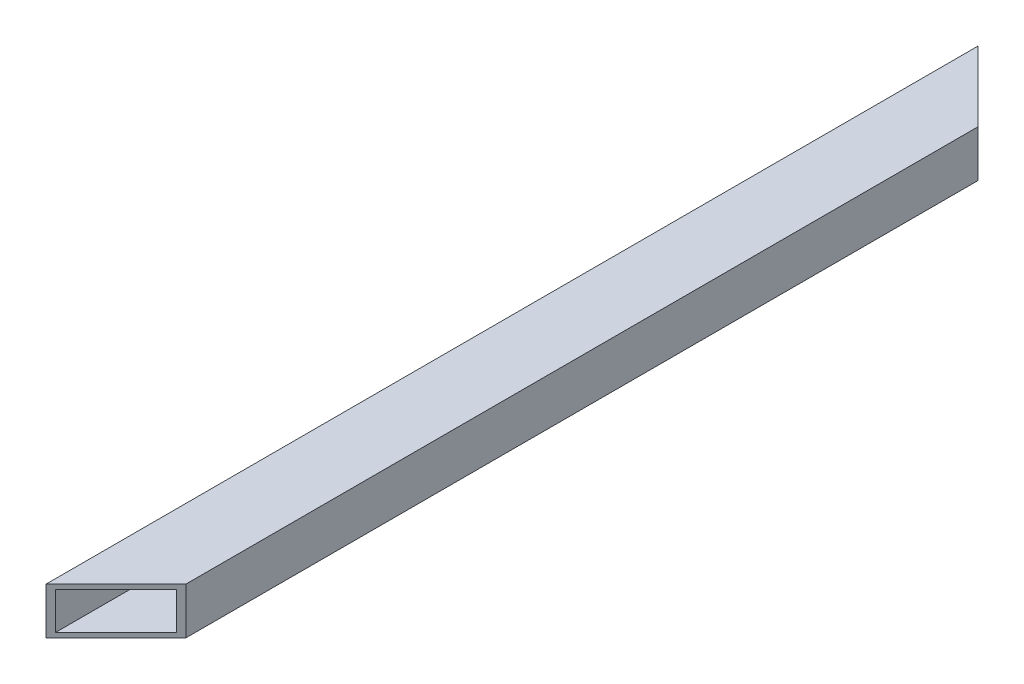
from build123d import *

# Parameters (mm, degrees)
SCHIZZO1_W                   = 30
SCHIZZO1_H                   = 20
SCHIZZO1_W_2                 = 26
SCHIZZO1_H_2                 = 16
ESTRUSIONE_ESTRUSIONE1_DEPTH = 400
TAGLIO_ESTRUSIONE1_DEPTH     = 401.780488547


with BuildPart() as part:
    # Schizzo1 → Estrusione-Estrusione1 (new body)
    with BuildSketch(Plane.XY):
        Rectangle(SCHIZZO1_W, SCHIZZO1_H)
        Rectangle(SCHIZZO1_W_2, SCHIZZO1_H_2, mode=Mode.SUBTRACT)
    extrude(amount=ESTRUSIONE_ESTRUSIONE1_DEPTH)

    # Schizzo2 → Taglio-Estrusione1 (cut, through all)
    with BuildSketch(Plane(origin=(0, 10, 0), x_dir=(1, 0, 0), z_dir=(0, 1, 0))):
        Polygon((-15, 0), (15, -30), (15, 0), align=None)
        Polygon((-15, -400), (15, -370), (15, -400), align=None)
    extrude(amount=-TAGLIO_ESTRUSIONE1_DEPTH, mode=Mode.SUBTRACT)


solid = part.part
